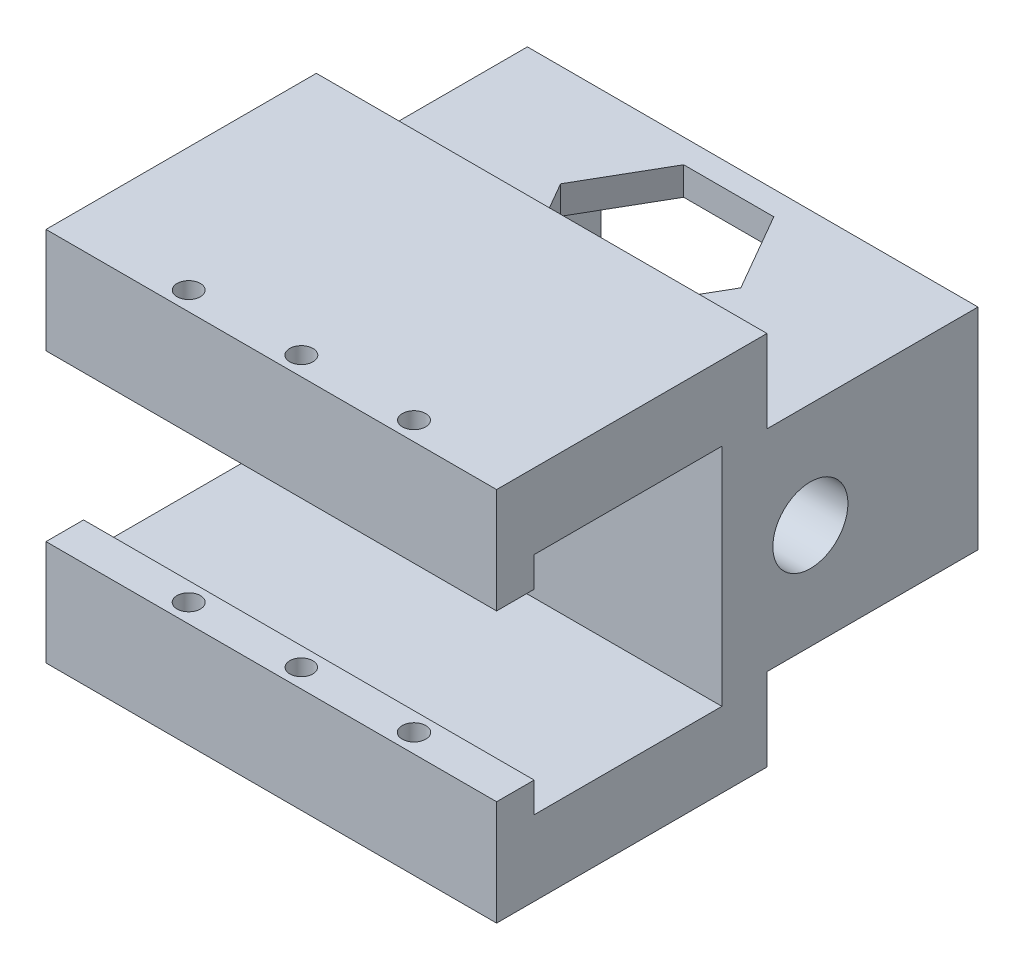
from build123d import *

# Parameters (mm, degrees)
SKETCH_1_W          = 60
SKETCH_1_H          = 50
EXTRUDE_1_DEPTH     = 6
SKETCH_2_W          = 60
SKETCH_2_H          = 10
EXTRUDE_3_DEPTH     = 30
SKETCH_3_W          = 60
SKETCH_3_H          = 5
EXTRUDE_4_DEPTH     = 4
SKETCH_4_W          = 60
SKETCH_4_H          = 5
EXTRUDE_5_DEPTH     = 4
SKETCH_6_R          = 1.555741847
SKETCH_6_R_2        = 1.533074906
SKETCH_6_R_3        = 1.574012297
CUT_EXTRUDE_1_DEPTH = 60.093146811
SKETCH_7_R          = 1.55
CUT_EXTRUDE_2_DEPTH = 60.093146811
SKETCH_9_W          = 60
SKETCH_9_H          = 28
SKETCH_9_W_2        = 40.4
SKETCH_9_H_2        = 20.5
EXTRUDE_6_DEPTH     = 28.1
SKETCH_11_R         = 5
CUT_EXTRUDE_3_DEPTH = 10
SKETCH_12_R         = 2.25
CUT_EXTRUDE_4_DEPTH = 16
CUT_EXTRUDE_5_DEPTH = 61.967204299


with BuildPart() as part:
    # 草图1 → 凸台-拉伸1 (new body)
    with BuildSketch(Plane.XY):
        Rectangle(SKETCH_1_W, SKETCH_1_H)
    extrude(amount=EXTRUDE_1_DEPTH)

    # 草图2 → 凸台-拉伸3 (add)
    with BuildSketch(Plane.XY.offset(6)):
        with Locations((0, 20)):
            Rectangle(SKETCH_2_W, SKETCH_2_H)
        with Locations((0, -20)):
            Rectangle(SKETCH_2_W, SKETCH_2_H)
    extrude(amount=EXTRUDE_3_DEPTH)

    # 草图3 → 凸台-拉伸4 (add)
    with BuildSketch(Plane(origin=(0, -15, 0), x_dir=(1, 0, 0), z_dir=(0, 1, 0))):
        with Locations((0, -33.5)):
            Rectangle(SKETCH_3_W, SKETCH_3_H)
    extrude(amount=EXTRUDE_4_DEPTH)

    # 草图4 → 凸台-拉伸5 (add)
    with BuildSketch(Plane.XZ.offset(-15)):
        with Locations((0, 33.5)):
            Rectangle(SKETCH_4_W, SKETCH_4_H)
    extrude(amount=EXTRUDE_5_DEPTH)

    # 草图6 → 切除-拉伸1 (cut, through all)
    with BuildSketch(Plane(origin=(0, -11, 0), x_dir=(1, 0, 0), z_dir=(0, 1, 0))):
        with Locations(Location((-13.5, -33.5, 0), (0, 0, 270))):
            Circle(SKETCH_6_R)
        with Locations(Location((1.5, -33.5, 0), (0, 0, 270))):
            Circle(SKETCH_6_R_2)
        with Locations(Location((16.5, -33.5, 0), (0, 0, 270))):
            Circle(SKETCH_6_R_3)
    extrude(amount=-CUT_EXTRUDE_1_DEPTH, mode=Mode.SUBTRACT)

    # 草图7 → 切除-拉伸2 (cut, through all)
    with BuildSketch(Plane.XZ.offset(-11)):
        with Locations(Location((16.5, 33.5, 0), (0, 0, 270))):
            Circle(SKETCH_7_R)
        with Locations(Location((1.5, 33.5, 0), (0, 0, 270))):
            Circle(SKETCH_7_R)
        with Locations(Location((-13.5, 33.5, 0), (0, 0, 270))):
            Circle(SKETCH_7_R)
    extrude(amount=-CUT_EXTRUDE_2_DEPTH, mode=Mode.SUBTRACT)

    # 草图9 → 凸台-拉伸6 (add)
    with BuildSketch(Plane(origin=(0, 0, 0), x_dir=(-1, 0, 0), z_dir=(0, 0, -1))):
        Rectangle(SKETCH_9_W, SKETCH_9_H)
        Rectangle(SKETCH_9_W_2, SKETCH_9_H_2, mode=Mode.SUBTRACT)
    extrude(amount=EXTRUDE_6_DEPTH)

    # 草图11 → 切除-拉伸3 (cut)
    with BuildSketch(Plane(origin=(30, 0, 0), x_dir=(0, 0, -1), z_dir=(1, 0, 0))):
        with Locations((5.781700187, 0)):
            Circle(SKETCH_11_R)
    extrude(amount=-CUT_EXTRUDE_3_DEPTH, mode=Mode.SUBTRACT)

    # 草图12 → 切除-拉伸4 (cut)
    with BuildSketch(Plane(origin=(0, 0, -28.1), x_dir=(-1, 0, 0), z_dir=(0, 0, -1))):
        with Locations((24.8, -5)):
            Circle(SKETCH_12_R)
        with Locations((24.8, 5)):
            Circle(SKETCH_12_R)
        with Locations((-24.8, -5)):
            Circle(SKETCH_12_R)
        with Locations((-24.8, 5)):
            Circle(SKETCH_12_R)
    extrude(amount=-CUT_EXTRUDE_4_DEPTH, mode=Mode.SUBTRACT)

    # 草图13 → 切除-拉伸5 (cut, through all)
    with BuildSketch(Plane(origin=(0, 14, 0), x_dir=(1, 0, 0), z_dir=(0, 1, 0))):
        Polygon((-12, 14.518770095), (-6, 4.12646525), (6, 4.12646525), (12, 14.518770095), (6, 24.911074941), (-6, 24.911074941), align=None)
    extrude(amount=-CUT_EXTRUDE_5_DEPTH, mode=Mode.SUBTRACT)


solid = part.part
